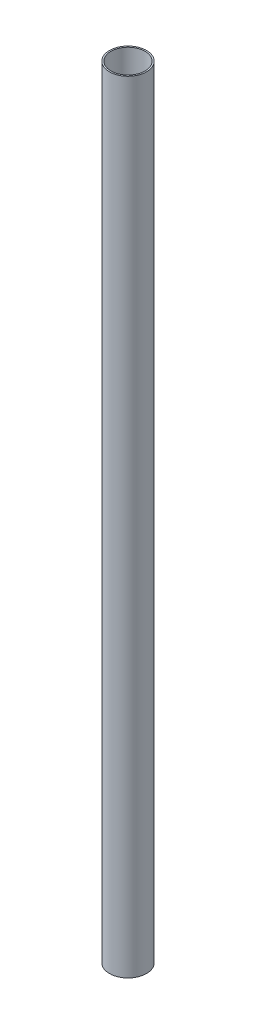
from build123d import *

# Parameters (mm, degrees)
SKETCH_1_R          = 19
SKETCH_1_R_2        = 17.5
EXTRUDE_1_DEPTH     = 800
SKETCH_2_R          = 4
CUT_EXTRUDE_1_DEPTH = 50


with BuildPart() as part:
    # 草图1 → 凸台-拉伸1 (new body)
    with BuildSketch(Plane(origin=(0, 0, 0), x_dir=(1, 0, 0), z_dir=(0, 1, 0))):
        with Locations(Location((0, 0, 0), (0, 0, 270))):
            Circle(SKETCH_1_R)
        with Locations(Location((0, 0, 0), (0, 0, 270))):
            Circle(SKETCH_1_R_2, mode=Mode.SUBTRACT)
    extrude(amount=EXTRUDE_1_DEPTH)

    # 草图2 → 切除-拉伸1 (cut)
    with BuildSketch(Plane(origin=(0, 0, 0), x_dir=(0, 0, -1), z_dir=(1, 0, 0))):
        with Locations((0, 60)):
            Circle(SKETCH_2_R)
        with Locations((0, 120)):
            Circle(SKETCH_2_R)
        with Locations((0, 180)):
            Circle(SKETCH_2_R)
        with Locations((0, 240)):
            Circle(SKETCH_2_R)
    extrude(amount=-CUT_EXTRUDE_1_DEPTH, mode=Mode.SUBTRACT)


solid = part.part
